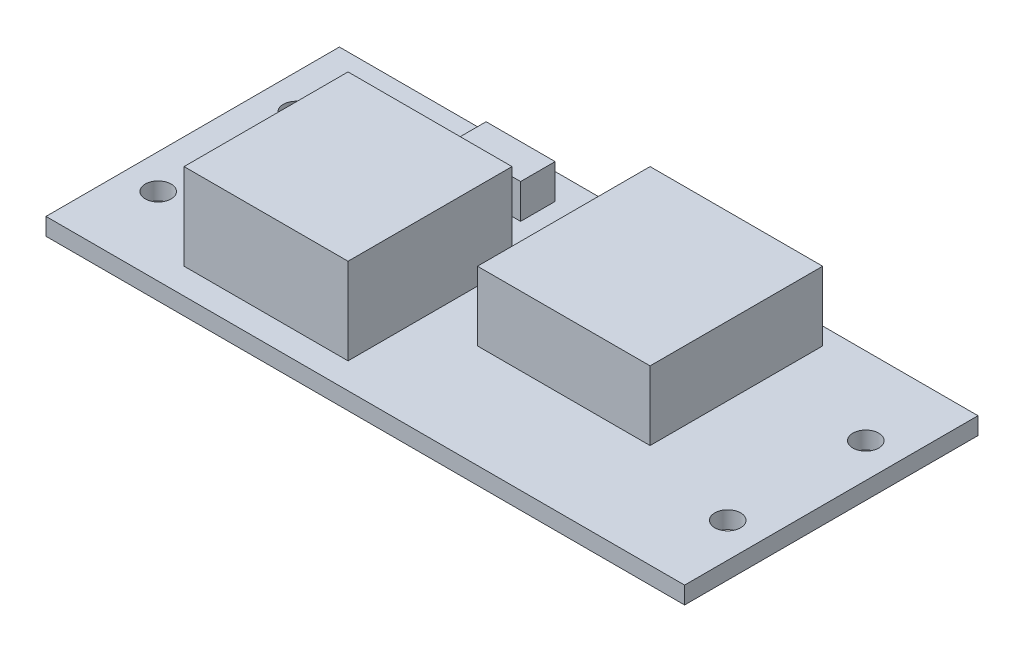
from build123d import *

# Parameters (mm, degrees)
SKETCH_1_W      = 37
SKETCH_1_H      = 17
SKETCH_1_R      = 0.75
EXTRUDE_1_DEPTH = 1
SKETCH_1_3_W    = 10
SKETCH_1_3_H    = 10
EXTRUDE_2_DEPTH = 4
SKETCH_1_4_W    = 9.5
SKETCH_1_4_H    = 9.5
EXTRUDE_3_DEPTH = 5
SKETCH_1_5_W    = 4
SKETCH_1_5_H    = 2
EXTRUDE_4_DEPTH = 2


with BuildPart() as part:
    # Эскиз1 → Бобышка-Вытянуть1 (new body)
    with BuildSketch(Plane(origin=(0, 0, 0), x_dir=(1, 0, 0), z_dir=(0, 1, 0))):
        Rectangle(SKETCH_1_W, SKETCH_1_H)
        with Locations((-16.5, -4)):
            Circle(SKETCH_1_R, mode=Mode.SUBTRACT)
        with Locations((16.5, -4)):
            Circle(SKETCH_1_R, mode=Mode.SUBTRACT)
        with Locations((-16.5, 4)):
            Circle(SKETCH_1_R, mode=Mode.SUBTRACT)
        with Locations((16.5, 4)):
            Circle(SKETCH_1_R, mode=Mode.SUBTRACT)
    extrude(amount=-EXTRUDE_1_DEPTH)

    # Эскиз1<3> → Бобышка-Вытянуть2 (add)
    with BuildSketch(Plane(origin=(0, 0, 0), x_dir=(1, 0, 0), z_dir=(0, 1, 0))):
        with Locations((5.5, 2.5)):
            Rectangle(SKETCH_1_3_W, SKETCH_1_3_H)
    extrude(amount=EXTRUDE_2_DEPTH)

    # Эскиз1<4> → Бобышка-Вытянуть3 (add)
    with BuildSketch(Plane(origin=(0, 0, 0), x_dir=(1, 0, 0), z_dir=(0, 1, 0))):
        with Locations((-7.25, -2.25)):
            Rectangle(SKETCH_1_4_W, SKETCH_1_4_H)
    extrude(amount=EXTRUDE_3_DEPTH)

    # Эскиз1<5> → Бобышка-Вытянуть4 (add)
    with BuildSketch(Plane(origin=(0, 0, 0), x_dir=(1, 0, 0), z_dir=(0, 1, 0))):
        with Locations((-6.5, 6)):
            Rectangle(SKETCH_1_5_W, SKETCH_1_5_H)
    extrude(amount=EXTRUDE_4_DEPTH)


solid = part.part
